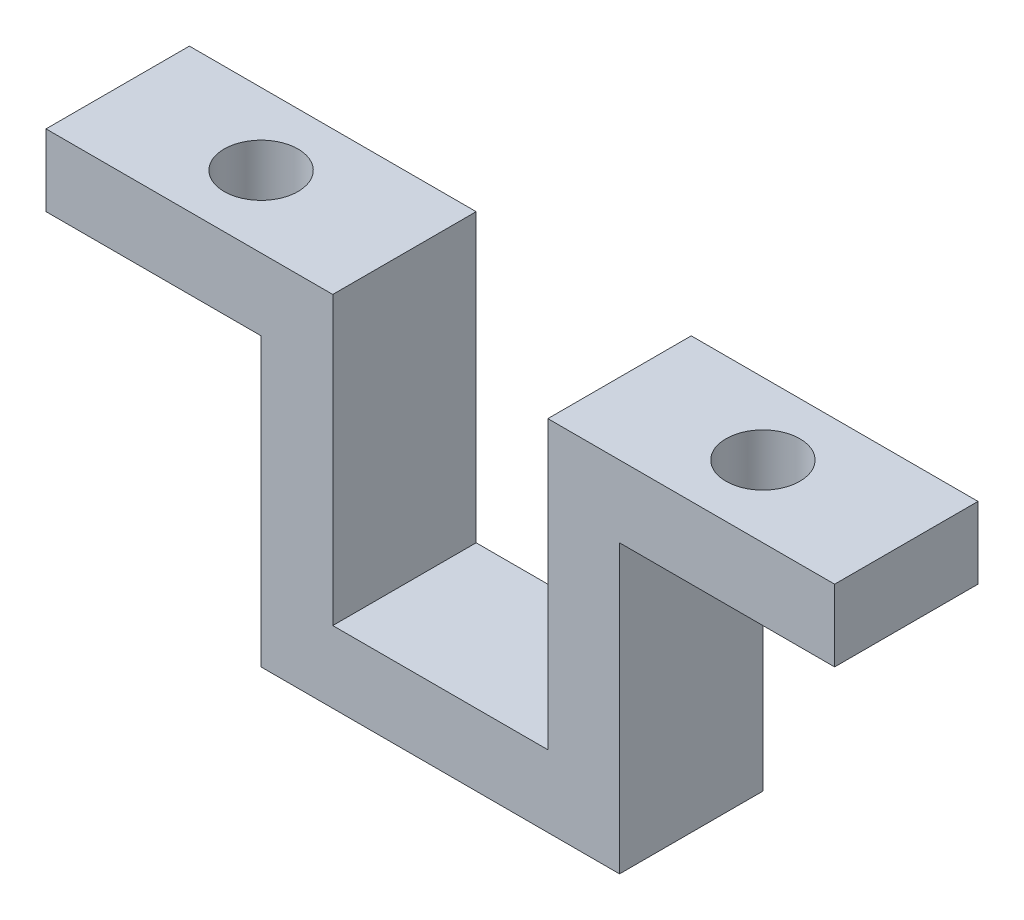
from build123d import *

# Parameters (mm, degrees)
BOSS_EXTRUDE1_DEPTH = 10
SKETCH2_R           = 2.575
CUT_EXTRUDE1_DEPTH  = 62.23724357


with BuildPart() as part:
    # Sketch1 → Boss-Extrude1 (new body)
    with BuildSketch(Plane.XY):
        Polygon((0, 0), (20, 0), (20, -20), (35, -20), (35, 0), (55, 0), (55, -5), (40, -5), (40, -25), (15, -25), (15, -5), (0, -5), align=None)
    extrude(amount=BOSS_EXTRUDE1_DEPTH)

    # Sketch2 → Cut-Extrude1 (cut, through all)
    with BuildSketch(Plane(origin=(0, 0, 0), x_dir=(1, 0, 0), z_dir=(0, 1, 0))):
        with Locations(Location((10, -5, 0), (0, 0, 180))):
            Circle(SKETCH2_R)
        with Locations(Location((45, -5, 0), (0, 0, 180))):
            Circle(SKETCH2_R)
    extrude(amount=-CUT_EXTRUDE1_DEPTH, mode=Mode.SUBTRACT)


solid = part.part
